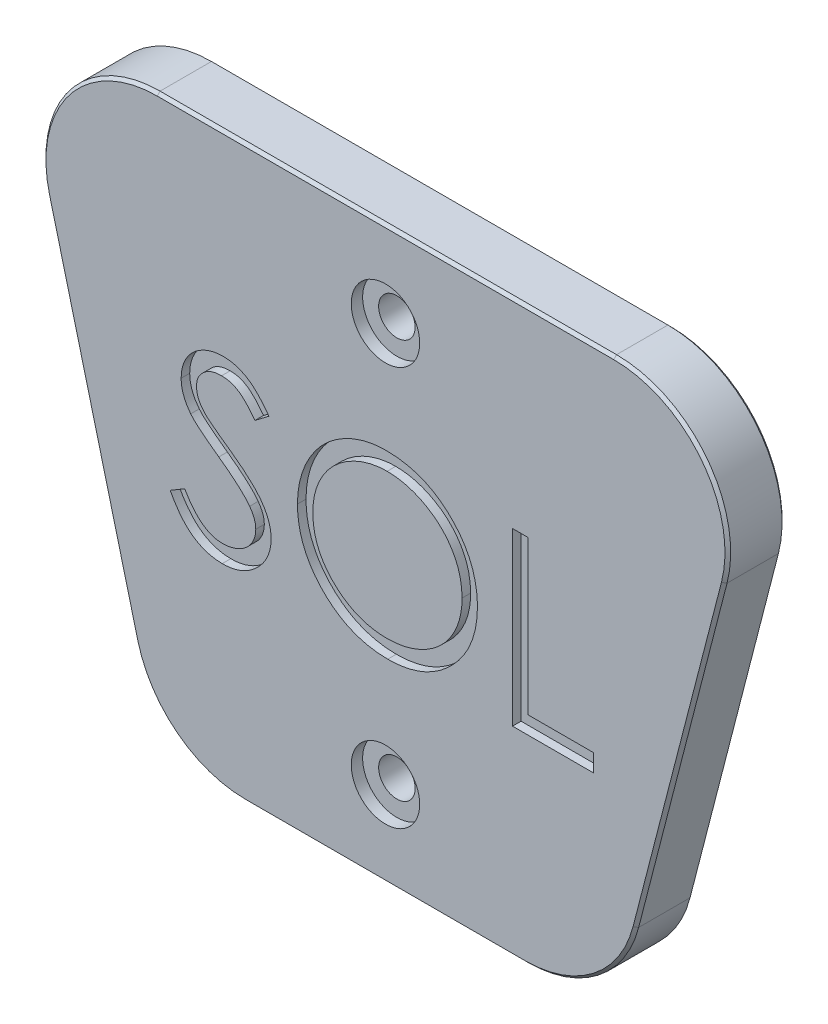
from build123d import *

# Parameters (mm, degrees)
BOSS_EXTRUDE1_DEPTH = 10
FILLET2_R           = 20
SKETCH10_R          = 6
CUT_EXTRUDE6_DEPTH  = 2
SKETCH11_R          = 3.2
CUT_EXTRUDE7_DEPTH  = 145.443760682
CUT_EXTRUDE8_DEPTH  = 1.5
CHAMFER1_SIZE       = 0.5


with BuildPart() as part:
    # Sketch2 → Boss-Extrude1 (new body)
    with BuildSketch(Plane.XY):
        with BuildLine():
            Line((20, -80), (100, -80))
            Line((100, -80), (119.364916731, -5))
            ThreePointArc((119.364916731, -5), (115.811388301, 12.247448714), (100, 20))
            Line((100, 20), (20, 20))
            ThreePointArc((20, 20), (4.188611699, 12.247448714), (0.635083269, -5))
            Line((0.635083269, -5), (20, -80))
        make_face()
    extrude(amount=BOSS_EXTRUDE1_DEPTH)

    # Fillet2
    fillet2_edges = [part.edges().sort_by_distance(p)[0] for p in [
        (100, -80, 5),
        (20, -80, 5),
    ]]
    fillet(fillet2_edges, radius=FILLET2_R)

    # Sketch10 → Cut-Extrude6 (cut)
    with BuildSketch(Plane.XY.offset(10)):
        with Locations((60, -65)):
            Circle(SKETCH10_R)
        with Locations((60, 5)):
            Circle(SKETCH10_R)
    extrude(amount=-CUT_EXTRUDE6_DEPTH, mode=Mode.SUBTRACT)

    # Sketch11 → Cut-Extrude7 (cut, through all)
    with BuildSketch(Plane.XY.offset(8)):
        with Locations((60, 5)):
            Circle(SKETCH11_R)
        with Locations((60, -65)):
            Circle(SKETCH11_R)
    extrude(amount=-CUT_EXTRUDE7_DEPTH, mode=Mode.SUBTRACT)

    # Sketch13 → Cut-Extrude8 (cut)
    # profile 1 of 3: a face of its own
    with BuildSketch(Plane.XY.offset(10)):
        with BuildLine():
            Line((22.269230769, -39.212740385), (24.805288462, -37.692307692))
            add(Edge.make_bspline(
                [(24.805288462, -37.692307692), (25.041159067, -38.087145278), (25.493078043, -38.843638854), (26.246946836, -39.865850629), (27.028086075, -40.734669116), (27.842280362, -41.445040037), (28.684559918, -42.004316209), (29.560423235, -42.400335338), (30.466918756, -42.647329413), (31.083837226, -42.677330155), (31.391826923, -42.692307692)],
                knots=[0, 0, 0, 0, 1.272034388, 2.437168799, 3.508375237, 4.49857839, 5.41946034, 6.295179144, 7.148887113, 8, 8, 8, 8], degree=3))
            add(Edge.make_bspline(
                [(31.391826923, -42.692307692), (31.654857156, -42.684981928), (32.176315211, -42.670458583), (32.943991579, -42.530908851), (33.689549884, -42.316519175), (34.397623922, -42.009482619), (35.058443475, -41.638009884), (35.637929435, -41.189328362), (36.138896119, -40.686989456), (36.54868853, -40.126566702), (36.863088832, -39.523848286), (37.104735133, -38.905197274), (37.238835764, -38.26089526), (37.259036508, -37.827091293), (37.269230769, -37.608173077)],
                knots=[0, 0, 0, 0, 1.095163259, 2.171163733, 3.241058638, 4.321873601, 5.38011039, 6.391990106, 7.366004449, 8.327778327, 9.272591725, 10.192022065, 11.087607919, 12, 12, 12, 12], degree=3))
            add(Edge.make_bspline(
                [(37.269230769, -37.608173077), (37.25659382, -37.358394365), (37.23090475, -36.850630744), (37.013777778, -36.101490861), (36.672212805, -35.360125975), (36.35710443, -34.901543699), (36.193509615, -34.663461538)],
                knots=[0, 0, 0, 0, 0.938893495, 1.908633276, 2.914225137, 4, 4, 4, 4], degree=3))
            add(Edge.make_bspline(
                [(36.193509615, -34.663461538), (36.059190065, -34.491631622), (35.777202971, -34.130896206), (35.292424292, -33.593937044), (34.723571884, -33.040064882), (34.090112842, -32.448130108), (33.36897208, -31.845663279), (32.582736242, -31.203935183), (31.711331737, -30.547350237), (31.100193194, -30.10701396), (30.784855769, -29.879807692)],
                knots=[0, 0, 0, 0, 0.722233717, 1.516239348, 2.393582979, 3.351407094, 4.387010283, 5.505090956, 6.712668013, 8, 8, 8, 8], degree=3))
            add(Edge.make_bspline(
                [(30.784855769, -29.879807692), (30.469221516, -29.654991227), (29.86575286, -29.225159265), (29.021822154, -28.58723683), (28.267155328, -28.004003663), (27.605106615, -27.469969274), (27.035967214, -26.985061233), (26.555252262, -26.55393604), (26.175207487, -26.16493409), (25.963873938, -25.912579732), (25.868990385, -25.799278846)],
                knots=[0, 0, 0, 0, 1.452282411, 2.77665338, 3.964542531, 5.026858415, 5.96415736, 6.766646006, 7.446254459, 8, 8, 8, 8], degree=3))
            add(Edge.make_bspline(
                [(25.868990385, -25.799278846), (25.736368568, -25.62269853), (25.475549968, -25.275429641), (25.131269921, -24.732645146), (24.838648526, -24.177017156), (24.609257107, -23.607052603), (24.416089517, -23.030753213), (24.286164397, -22.440599678), (24.204809566, -21.839240091), (24.196478253, -21.434552943), (24.192307692, -21.231971154)],
                knots=[0, 0, 0, 0, 1.068054152, 2.10047183, 3.106115577, 4.101338837, 5.06977816, 6.043150881, 7.020423561, 8, 8, 8, 8], degree=3))
            add(Edge.make_bspline(
                [(24.192307692, -21.231971154), (24.203495198, -20.914573086), (24.225631084, -20.286561111), (24.412835518, -19.369153993), (24.708317464, -18.493270417), (25.122273645, -17.667581842), (25.655908099, -16.91358772), (26.273445022, -16.222614975), (27.008972047, -15.641741413), (27.815994532, -15.134209484), (28.699334864, -14.736958696), (29.624971179, -14.437293152), (30.594374653, -14.267499515), (31.25097295, -14.243132958), (31.584134615, -14.230769231)],
                knots=[0, 0, 0, 0, 1.005424448, 1.989358655, 2.955360095, 3.929531133, 4.905563448, 5.876582895, 6.856512386, 7.866279853, 8.892233794, 9.918561126, 10.94386622, 12, 12, 12, 12], degree=3))
            add(Edge.make_bspline(
                [(31.584134615, -14.230769231), (31.937655475, -14.24296253), (32.640695633, -14.267211111), (33.674831766, -14.478047094), (34.67049505, -14.826909995), (35.47143732, -15.222812777), (36.098289561, -15.618224912), (36.576341555, -15.978394835), (37.060776848, -16.393038623), (37.555503032, -16.863260732), (38.052137256, -17.393375741), (38.558052561, -17.979753075), (39.074432008, -18.618809268), (39.406625094, -19.075019274), (39.576923077, -19.308894231)],
                knots=[0, 0, 0, 0, 1.286793592, 2.559021753, 3.825965368, 5.121522368, 5.803751409, 6.523245864, 7.299691795, 8.125521123, 9.008227632, 9.944561021, 10.946284179, 12, 12, 12, 12], degree=3))
            Line((39.576923077, -19.308894231), (37.143028846, -21.153846154))
            add(Edge.make_bspline(
                [(37.143028846, -21.153846154), (36.996063711, -20.964514522), (36.713043221, -20.599906065), (36.283361906, -20.089294789), (35.878373495, -19.622867821), (35.479370068, -19.217738153), (35.107424656, -18.851719867), (34.746421436, -18.538350523), (34.401555568, -18.274559705), (33.966839192, -17.993043476), (33.42068732, -17.713987732), (32.735105581, -17.477852777), (32.018651795, -17.335952246), (31.530683525, -17.317190353), (31.283653846, -17.307692308)],
                knots=[0, 0, 0, 0, 1.181633172, 2.275549214, 3.290209073, 4.226197932, 5.078386478, 5.862611352, 6.581680152, 7.217281963, 8.414376989, 9.595101626, 10.782541182, 12, 12, 12, 12], degree=3))
            add(Edge.make_bspline(
                [(31.283653846, -17.307692308), (30.973740797, -17.318078307), (30.376102676, -17.338106729), (29.527614938, -17.55684946), (28.763952723, -17.901265406), (28.10778788, -18.383965218), (27.561470934, -18.955859441), (27.166281287, -19.613963913), (26.928422734, -20.340670221), (26.89939748, -20.847598704), (26.884615385, -21.105769231)],
                knots=[0, 0, 0, 0, 1.14458467, 2.207223713, 3.21896685, 4.227309161, 5.202851033, 6.127160689, 7.046193047, 8, 8, 8, 8], degree=3))
            add(Edge.make_bspline(
                [(26.884615385, -21.105769231), (26.887985041, -21.26649619), (26.894729865, -21.588212928), (26.98879956, -22.06351083), (27.109650951, -22.537608025), (27.301159223, -23.008373021), (27.56554754, -23.484038956), (27.912734762, -23.972796706), (28.349991722, -24.478954209), (28.684937542, -24.80816027), (28.861778846, -24.981971154)],
                knots=[0, 0, 0, 0, 0.858281714, 1.717966888, 2.583508476, 3.4729293, 4.427298488, 5.488583878, 6.674047936, 8, 8, 8, 8], degree=3))
            add(Edge.make_bspline(
                [(28.861778846, -24.981971154), (28.927447753, -25.040574232), (29.083462042, -25.179801732), (29.368684263, -25.407735566), (29.745336819, -25.688902186), (30.203584258, -26.03679347), (30.75187593, -26.44034886), (31.390272125, -26.894408392), (32.111656692, -27.413712327), (32.623558829, -27.776776961), (32.894230769, -27.96875)],
                knots=[0, 0, 0, 0, 0.420754252, 0.999615792, 1.744751191, 2.668019286, 3.750313428, 4.999500688, 6.413464383, 8, 8, 8, 8], degree=3))
            add(Edge.make_bspline(
                [(32.894230769, -27.96875), (33.219824312, -28.205675939), (33.850291081, -28.664450183), (34.747356051, -29.35372744), (35.560731549, -30.027851171), (36.293273294, -30.682516374), (36.952218224, -31.312757171), (37.53025583, -31.92615586), (38.033275947, -32.518317912), (38.574812105, -33.277511417), (39.128164844, -34.209920711), (39.603377765, -35.352305613), (39.903020743, -36.499131217), (39.942205161, -37.269932673), (39.961538462, -37.650240385)],
                knots=[0, 0, 0, 0, 1.163667725, 2.253281268, 3.268753668, 4.215851969, 5.092017293, 5.902905408, 6.650798638, 7.335211899, 8.59617414, 9.77448103, 10.901945474, 12, 12, 12, 12], degree=3))
            add(Edge.make_bspline(
                [(39.961538462, -37.650240385), (39.955905849, -37.9191978), (39.944750006, -38.451889659), (39.816513602, -39.234076032), (39.628630758, -39.993769201), (39.345454467, -40.721578736), (38.999827396, -41.430819559), (38.561259557, -42.102887277), (38.052907973, -42.752656407), (37.469761417, -43.362800619), (36.831653683, -43.92291087), (36.157222014, -44.421159969), (35.445362532, -44.836602741), (34.699936961, -45.175609958), (33.920774074, -45.440754394), (33.108135927, -45.632864701), (32.260682974, -45.750770795), (31.684678846, -45.76300875), (31.391826923, -45.769230769)],
                knots=[0, 0, 0, 0, 0.983748083, 1.948392443, 2.894712957, 3.844097841, 4.80183111, 5.778335162, 6.776009319, 7.81870978, 8.863265674, 9.881300176, 10.883814829, 11.87499822, 12.874611388, 13.892143829, 14.928324115, 16, 16, 16, 16], degree=3))
            add(Edge.make_bspline(
                [(31.391826923, -45.769230769), (31.165238269, -45.764849213), (30.714914611, -45.756141281), (30.048833338, -45.679158877), (29.396208288, -45.570240846), (28.765228728, -45.397320247), (28.147765199, -45.187517586), (27.546503189, -44.929189021), (26.961151299, -44.619613009), (26.38842916, -44.265655655), (25.829793378, -43.85373213), (25.290483653, -43.373959303), (24.75280492, -42.83956926), (24.232627237, -42.236050146), (23.719428857, -41.573152293), (23.223328204, -40.844673578), (22.734056338, -40.054581974), (22.427066614, -39.498595525), (22.269230769, -39.212740385)],
                knots=[0, 0, 0, 0, 0.915332311, 1.819136955, 2.706846663, 3.586547465, 4.459518054, 5.340707479, 6.227863349, 7.133153174, 8.059268498, 9.028702269, 10.047606654, 11.120612155, 12.245963614, 13.433783089, 14.680604001, 16, 16, 16, 16], degree=3))
        make_face()
    # profile 2 of 3: a face of its own
    with BuildSketch(Plane.XY.offset(10)):
        with BuildLine():
            add(Edge.make_bspline(
                [(60.153846154, -14.230769231), (60.709344204, -14.244839054), (61.800388207, -14.272473347), (63.40388733, -14.484008521), (64.934702433, -14.849969006), (66.405303622, -15.337365999), (67.798100565, -15.987546445), (69.123576786, -16.773419145), (70.378578562, -17.703217363), (71.546190403, -18.769753593), (72.614678548, -19.930183198), (73.556043288, -21.168565284), (74.344977234, -22.477412161), (74.99285541, -23.85279071), (75.501129207, -25.291590435), (75.851863867, -26.801481887), (76.075905154, -28.372682088), (76.102097532, -29.444340928), (76.115384615, -29.987980769)],
                knots=[0, 0, 0, 0, 1.065120563, 2.091984664, 3.0946048, 4.079830382, 5.057816894, 6.036188127, 7.030412546, 8.04752943, 9.064399622, 10.05169764, 11.02544977, 11.989514704, 12.962713494, 13.945757189, 14.957906945, 16, 16, 16, 16], degree=3))
            add(Edge.make_bspline(
                [(76.115384615, -29.987980769), (76.102099479, -30.527616024), (76.075912937, -31.591299627), (75.85160913, -33.152529149), (75.49982913, -34.653306547), (74.99757542, -36.091126428), (74.352785605, -37.467505546), (73.558598424, -38.778822294), (72.623102332, -40.025506566), (71.55847218, -41.193900839), (70.39789182, -42.265307731), (69.153060961, -43.198898094), (67.851975362, -44.002247733), (66.477892149, -44.643250653), (65.049034691, -45.155581399), (63.552614778, -45.504889657), (61.995644315, -45.73020717), (60.933892854, -45.756080164), (60.394230769, -45.769230769)],
                knots=[0, 0, 0, 0, 1.043624062, 2.057103931, 3.04512605, 4.022047818, 4.998200453, 5.980619268, 6.982898556, 8.009068085, 9.034988726, 10.034168286, 11.015286542, 11.987931943, 12.962482838, 13.94673481, 14.956375938, 16, 16, 16, 16], degree=3))
            add(Edge.make_bspline(
                [(60.394230769, -45.769230769), (59.850593749, -45.75595031), (58.77894047, -45.729770991), (57.205765881, -45.50535895), (55.694813791, -45.154433489), (54.250405066, -44.652924035), (52.871734241, -44.004776344), (51.556104961, -43.214453094), (50.308797984, -42.276677599), (49.140154443, -41.212392674), (48.070875602, -40.053779371), (47.138652381, -38.812342899), (46.34815141, -37.512438984), (45.702179989, -36.150460206), (45.190770337, -34.732990697), (44.841871896, -33.250575176), (44.616135164, -31.711665126), (44.590122194, -30.663868855), (44.576923077, -30.132211538)],
                knots=[0, 0, 0, 0, 1.053102029, 2.075944431, 3.073151272, 4.055350789, 5.033113405, 6.020478099, 7.024410459, 8.052272461, 9.079885166, 10.07527673, 11.055994387, 12.023226415, 12.992069828, 13.970394897, 14.97016774, 16, 16, 16, 16], degree=3))
            add(Edge.make_bspline(
                [(44.576923077, -30.132211538), (44.581505667, -29.775360089), (44.590613036, -29.06615903), (44.700256114, -28.013016743), (44.85935641, -26.976811105), (45.087372803, -25.960488694), (45.385587092, -24.966537396), (45.737461612, -23.988102286), (46.167231715, -23.03509894), (46.653065841, -22.103012725), (47.19530991, -21.206373533), (47.794244905, -20.358834248), (48.428833778, -19.553282847), (49.124520009, -18.810594243), (49.858375254, -18.109162903), (50.642304209, -17.459768185), (51.471523446, -16.85655432), (52.349600987, -16.312951396), (53.254900486, -15.821301671), (54.18813001, -15.399400091), (55.136614909, -15.037290993), (56.104797605, -14.743798205), (57.09010708, -14.51209504), (58.094693805, -14.354317722), (59.117757459, -14.244394997), (59.806997336, -14.235330695), (60.153846154, -14.230769231)],
                knots=[0, 0, 0, 0, 1.037015668, 2.060948919, 3.074880161, 4.083647147, 5.086022904, 6.090072063, 7.104153813, 8.122640571, 9.144368836, 10.147691507, 11.138137339, 12.123020368, 13.103399296, 14.087645067, 15.080126199, 16.082011238, 17.087798457, 18.072939717, 19.057185487, 20.037253025, 21.01195951, 21.997135196, 22.992090687, 24, 24, 24, 24], degree=3))
        make_face()
        with BuildLine():
            add(Edge.make_bspline(
                [(60.286057692, -17.307692308), (60.001360833, -17.311162796), (59.434688837, -17.318070593), (58.592249955, -17.409062441), (57.760890522, -17.538747204), (56.940438846, -17.723731667), (56.134327794, -17.975766405), (55.335043441, -18.265831333), (54.549874408, -18.619154966), (53.781412769, -19.018349575), (53.036426411, -19.460197468), (52.333460399, -19.9485269), (51.670694879, -20.471885936), (51.049752593, -21.031495971), (50.472456832, -21.630206843), (49.927445105, -22.25894201), (49.436562977, -22.935672505), (48.986686604, -23.642047421), (48.584105116, -24.377146688), (48.226116361, -25.133231222), (47.933282, -25.916468537), (47.694461632, -26.718361316), (47.496463253, -27.537639542), (47.371029618, -28.380518246), (47.279037965, -29.242762064), (47.272525004, -29.82546367), (47.269230769, -30.120192308)],
                knots=[0, 0, 0, 0, 1.008559885, 2.007477868, 2.99961109, 3.989939068, 4.984837346, 5.991145699, 7.001802488, 8.033829008, 9.059044045, 10.069351652, 11.065060232, 12.050310815, 13.029377138, 14.011219647, 14.996725999, 15.989392538, 16.977580475, 17.965360261, 18.951710183, 19.937753436, 20.929683414, 21.935841486, 22.955955122, 24, 24, 24, 24], degree=3))
            add(Edge.make_bspline(
                [(47.269230769, -30.120192308), (47.280158157, -30.553582772), (47.301655711, -31.406195888), (47.489863454, -32.655637122), (47.779766093, -33.856393862), (48.207114948, -35.001895941), (48.741548788, -36.101989794), (49.401779276, -37.146916406), (50.184000009, -38.136958186), (51.072544523, -39.065203349), (52.043882008, -39.912453099), (53.075305407, -40.656139459), (54.1557649, -41.285370172), (55.288078066, -41.797985078), (56.466199829, -42.204182831), (57.697721695, -42.482571097), (58.97443992, -42.665789286), (59.844702679, -42.683384337), (60.286057692, -42.692307692)],
                knots=[0, 0, 0, 0, 1.032063989, 2.030389145, 3.003944642, 3.970395727, 4.937377036, 5.913328081, 6.909231446, 7.93887556, 8.970685674, 9.976071282, 10.964166581, 11.944589148, 12.933237628, 13.927779006, 14.949070134, 16, 16, 16, 16], degree=3))
            add(Edge.make_bspline(
                [(60.286057692, -42.692307692), (60.582710563, -42.688231941), (61.171062304, -42.680148501), (62.046166781, -42.598731271), (62.905505739, -42.46817239), (63.747873852, -42.280195342), (64.572315092, -42.044933573), (65.382270548, -41.765438762), (66.169113036, -41.41674273), (66.942768789, -41.031474574), (67.683308003, -40.592273223), (68.390241137, -40.120517655), (69.045749536, -39.597929477), (69.666227291, -39.046633941), (70.245893197, -38.455515245), (70.780827347, -37.825341915), (71.26922848, -37.152136282), (71.718934022, -36.446832804), (72.120104846, -35.709722067), (72.46963998, -34.950896256), (72.766178116, -34.17222389), (73.0055653, -33.372581848), (73.193154972, -32.553488859), (73.322411428, -31.713848189), (73.412826617, -30.855339539), (73.419641564, -30.274677917), (73.423076923, -29.981971154)],
                knots=[0, 0, 0, 0, 1.047197238, 2.076906641, 3.100256066, 4.114471768, 5.12198147, 6.126382909, 7.136867548, 8.15857795, 9.17633901, 10.174870724, 11.156907918, 12.133735059, 13.104061851, 14.077631395, 15.04955518, 16.038496417, 17.029181396, 18.010275684, 18.986308667, 19.968651475, 20.955262928, 21.950658345, 22.966943676, 24, 24, 24, 24], degree=3))
            add(Edge.make_bspline(
                [(73.423076923, -29.981971154), (73.419638812, -29.691266832), (73.412818685, -29.114601259), (73.322454617, -28.262079958), (73.193018413, -27.428481003), (73.006480916, -26.617076977), (72.766051027, -25.827661048), (72.469588195, -25.060974639), (72.119999914, -24.314161538), (71.718786562, -23.589067564), (71.267793789, -22.893284096), (70.774985989, -22.22812056), (70.231854434, -21.606068491), (69.653917078, -21.011771114), (69.026738061, -20.457903489), (68.353158397, -19.944281883), (67.641355445, -19.458510961), (66.887693427, -19.020291859), (66.109888109, -18.615598436), (65.31176847, -18.268875552), (64.502376187, -17.974257386), (63.68376951, -17.722969114), (62.849058267, -17.539471712), (62.003882591, -17.408945571), (61.149411803, -17.318102263), (60.574755634, -17.311173304), (60.286057692, -17.307692308)],
                knots=[0, 0, 0, 0, 1.02996197, 2.043119294, 3.035359645, 4.018872909, 4.991431989, 5.957985074, 6.929999688, 7.912076566, 8.892894881, 9.867085534, 10.843653904, 11.817741046, 12.803660682, 13.806313499, 14.818574707, 15.856120519, 16.894564902, 17.924820532, 18.937903209, 19.946497019, 20.957711757, 21.963978472, 22.977135795, 24, 24, 24, 24], degree=3))
        make_face(mode=Mode.SUBTRACT)
    # profile 3 of 3: a face of its own
    with BuildSketch(Plane.XY.offset(10)):
        Polygon((82.269230769, -15), (84.961538462, -15), (84.961538462, -41.923076923), (96.5, -41.923076923), (96.5, -45), (82.269230769, -45), align=None)
    extrude(amount=-CUT_EXTRUDE8_DEPTH, mode=Mode.SUBTRACT)

    # Chamfer1
    chamfer1_edges = [part.edges().sort_by_distance(p)[0] for p in [
        (111.618950039, -35, 0),
        (8.381049961, -35, 0),
        (4.188611699, 12.247448714, 0),
        (60, 20, 0),
        (4.188611699, 12.247448714, 10),
        (8.381049961, -35, 10),
        (60, -80, 0),
        (60, -80, 10),
        (96.755515329, -75.811388301, 0),
        (23.244484671, -75.811388301, 0),
        (96.755515329, -75.811388301, 10),
        (23.244484671, -75.811388301, 10),
        (111.618950039, -35, 10),
        (115.811388301, 12.247448714, 10),
        (60, 20, 10),
        (56.8, 5, 0),
        (56.8, -65, 0),
        (115.811388301, 12.247448714, 0),
    ]]
    chamfer(chamfer1_edges, length=CHAMFER1_SIZE)


solid = part.part
